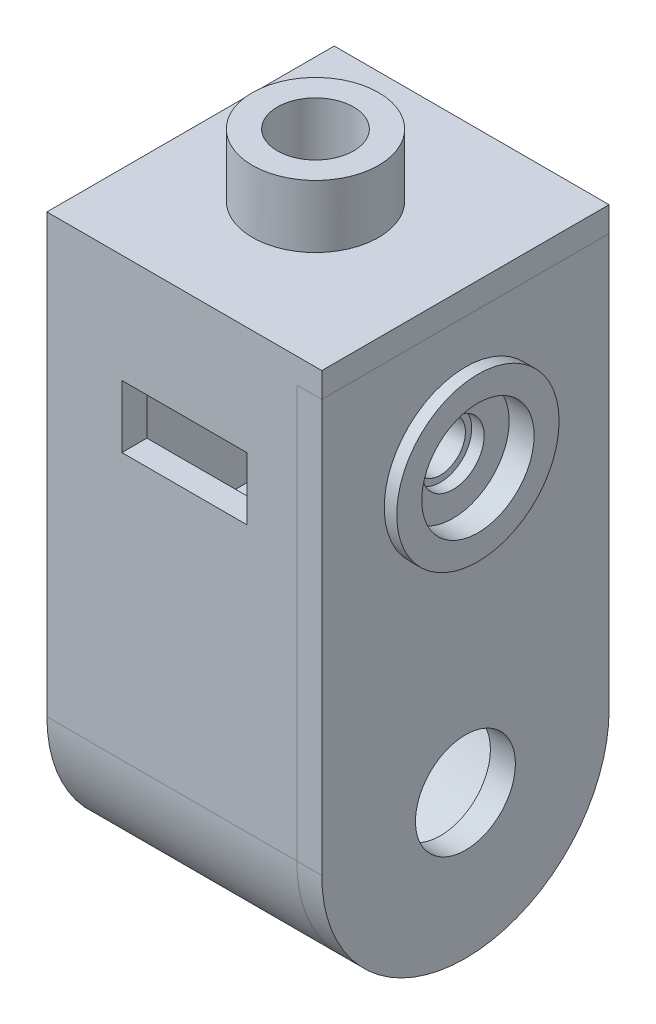
from build123d import *

# Parameters (mm, degrees)
SKETCH1_R            = 5.05
SKETCH1_R_2          = 3.05
BOSS_EXTRUDE1_DEPTH  = 7
SKETCH2_R            = 3.05
BOSS_EXTRUDE2_DEPTH  = 2
SKETCH3_W            = 20
SKETCH3_H            = 2
BOSS_EXTRUDE3_DEPTH  = 35
BOSS_EXTRUDE4_DEPTH  = 20
SKETCH5_W            = 8.1
SKETCH5_H            = 2
BOSS_EXTRUDE5_DEPTH  = 19
BOSS_EXTRUDE6_DEPTH  = 8.1
BOSS_EXTRUDE7_DEPTH  = 2
SKETCH8_R            = 3.9
BOSS_EXTRUDE8_DEPTH  = 7
SKETCH9_R            = 4
BOSS_EXTRUDE9_DEPTH  = 18
SKETCH10_R           = 2
CUT_EXTRUDE1_DEPTH   = 6
CUT_EXTRUDE1_DRAFT   = -2
BOSS_EXTRUDE10_DEPTH = 2
CUT_EXTRUDE2_DEPTH   = 2
BOSS_EXTRUDE11_START = -2
SKETCH13_W           = 22
SKETCH13_H           = 23
SKETCH13_R           = 5.05
BOSS_EXTRUDE11_DEPTH = 2
SKETCH14_R           = 2.5
CUT_EXTRUDE3_DEPTH   = 2
SKETCH15_R           = 4.5
SKETCH15_R_2         = 2.5
CUT_EXTRUDE4_DEPTH   = 1
SKETCH16_R           = 6.5
SKETCH16_R_2         = 4.5
BOSS_EXTRUDE12_DEPTH = 1
SKETCH18_R           = 4
CUT_EXTRUDE6_DEPTH   = 2
SKETCH19_W           = 10
SKETCH19_H           = 5
CUT_EXTRUDE7_DEPTH   = 2
SKETCH20_W           = 10
SKETCH20_H           = 5
CUT_EXTRUDE8_DEPTH   = 2
SKETCH21_R           = 2
BOSS_EXTRUDE13_DEPTH = 2


with BuildPart() as part:
    # Sketch1 → Boss-Extrude1 (new body)
    with BuildSketch(Plane(origin=(0, 0, 0), x_dir=(1, 0, 0), z_dir=(0, 1, 0))):
        with Locations(Location((0, 0, 0), (0, 0, 270))):
            Circle(SKETCH1_R)
        with Locations(Location((0, 0, 0), (0, 0, 270))):
            Circle(SKETCH1_R_2, mode=Mode.SUBTRACT)
    extrude(amount=BOSS_EXTRUDE1_DEPTH)

    # Sketch2 → Boss-Extrude2 (add)
    with BuildSketch(Plane.XZ):
        with BuildLine():
            Line((-10, 11.5), (10, 11.5))
            ThreePointArc((10, 11.5), (21.5, 0), (10, -11.5))
            Line((10, -11.5), (-10, -11.5))
            ThreePointArc((-10, -11.5), (-21.5, 0), (-10, 11.5))
        make_face()
        with Locations(Location((0, 0, 0), (0, 0, 90))):
            Circle(SKETCH2_R, mode=Mode.SUBTRACT)
    extrude(amount=-BOSS_EXTRUDE2_DEPTH)

    # Sketch3 → Boss-Extrude3 (add)
    with BuildSketch(Plane(origin=(0, 2, 0), x_dir=(1, 0, 0), z_dir=(0, 1, 0))):
        with Locations((0, 10.5)):
            Rectangle(SKETCH3_W, SKETCH3_H)
        with Locations((0, -10.5)):
            Rectangle(SKETCH3_W, SKETCH3_H)
    extrude(amount=-BOSS_EXTRUDE3_DEPTH)

    # Sketch4 → Boss-Extrude4 (add)
    with BuildSketch(Plane.ZY.offset(10)):
        with BuildLine():
            Line((-11.5, -33), (-9.5, -33))
            ThreePointArc((-9.5, -33), (0, -42.5), (9.5, -33))
            Line((9.5, -33), (11.5, -33))
            ThreePointArc((11.5, -33), (0, -44.5), (-11.5, -33))
        make_face()
    extrude(amount=-BOSS_EXTRUDE4_DEPTH)

    # Sketch5 → Boss-Extrude5 (add)
    with BuildSketch(Plane(origin=(0, 0, 9.5), x_dir=(-1, 0, 0), z_dir=(0, 0, -1))):
        with Locations((5.95, -23.78)):
            Rectangle(SKETCH5_W, SKETCH5_H)
    extrude(amount=BOSS_EXTRUDE5_DEPTH)

    # Sketch6 → Boss-Extrude6 (add)
    with BuildSketch(Plane.ZY.offset(10)):
        with BuildLine():
            Line((9.5, -24.78), (2.693343647, -24.78))
            ThreePointArc((2.693343647, -24.78), (0, -41.65), (-2.693343647, -24.78))
            Line((-2.693343647, -24.78), (-9.5, -24.78))
            Line((-9.5, -24.78), (-9.5, -33))
            ThreePointArc((-9.5, -33), (0, -42.5), (9.5, -33))
            Line((9.5, -33), (9.5, -24.78))
        make_face()
    extrude(amount=-BOSS_EXTRUDE6_DEPTH)

    # Sketch7 → Boss-Extrude7 (add)
    with BuildSketch(Plane.ZY.offset(10)):
        with BuildLine():
            Line((-11.5, 2), (11.5, 2))
            Line((11.5, 2), (11.5, -33))
            ThreePointArc((11.5, -33), (0, -44.5), (-11.5, -33))
            Line((-11.5, -33), (-11.5, 2))
        make_face()
    extrude(amount=-BOSS_EXTRUDE7_DEPTH)

    # Sketch8 → Boss-Extrude8 (add)
    with BuildSketch(Plane.ZY.offset(10)):
        with Locations((0, -33)):
            Circle(SKETCH8_R)
    extrude(amount=BOSS_EXTRUDE8_DEPTH)

    # Sketch9 → Boss-Extrude9 (add)
    with BuildSketch(Plane(origin=(-8, 0, 0), x_dir=(0, 0, -1), z_dir=(1, 0, 0))):
        with Locations(Location((0, -10, 0), (0, 0, 180))):
            Circle(SKETCH9_R)
    extrude(amount=BOSS_EXTRUDE9_DEPTH)


with BuildPart() as cut_extrude1_tool:
    # Sketch10 → Cut-Extrude1 (with draft: the straight prism first)
    with BuildSketch(Plane(origin=(10, 0, 0), x_dir=(0, 0, -1), z_dir=(1, 0, 0))):
        with Locations((0, -10)):
            Circle(SKETCH10_R)
    extrude(amount=-CUT_EXTRUDE1_DEPTH)
    # Cut-Extrude1: the draft: its side faces are tilted about the plane it starts from
    cut_extrude1_sides = [cut_extrude1_tool.faces().sort_by_distance(p)[0] for p in [
        (7, -10, 2),
    ]]
    draft(cut_extrude1_sides, Plane(origin=(10, 0, 0), x_dir=(0, 0, -1), z_dir=(1, 0, 0)), CUT_EXTRUDE1_DRAFT)


with BuildPart() as part_1:
    add(part.part)

    # Cut-Extrude1: cut by cut_extrude1_tool
    add(cut_extrude1_tool.part, mode=Mode.SUBTRACT)

    # Sketch12 → Cut-Extrude2 (cut)
    with BuildSketch(Plane.XZ):
        with BuildLine():
            Line((-10, 11.5), (-10, -11.5))
            ThreePointArc((-10, -11.5), (-21.5, 0), (-10, 11.5))
        make_face()
        with BuildLine():
            Line((12, 11.324751653), (12, -11.324751653))
            ThreePointArc((12, -11.324751653), (21.5, 0), (12, 11.324751653))
        make_face()
    extrude(amount=-CUT_EXTRUDE2_DEPTH, mode=Mode.SUBTRACT)

    # Sketch13 → Boss-Extrude11 (add)
    with BuildSketch(Plane(origin=(0, 2, 0), x_dir=(1, 0, 0), z_dir=(0, 1, 0)).offset(BOSS_EXTRUDE11_START)):
        with Locations((1, 0)):
            Rectangle(SKETCH13_W, SKETCH13_H)
        with Locations(Location((0, 0, 0), (0, 0, 90))):
            Circle(SKETCH13_R, mode=Mode.SUBTRACT)
    extrude(amount=BOSS_EXTRUDE11_DEPTH)

    # Sketch19 → Cut-Extrude7 (cut)
    with BuildSketch(Plane(origin=(0, 0, -11.5), x_dir=(-1, 0, 0), z_dir=(0, 0, -1))):
        with Locations((-1, -9.184069539)):
            Rectangle(SKETCH19_W, SKETCH19_H)
    extrude(amount=-CUT_EXTRUDE7_DEPTH, mode=Mode.SUBTRACT)

    # Sketch20 → Cut-Extrude8 (cut)
    with BuildSketch(Plane.XY.offset(11.5)):
        with Locations((1, -9.184069539)):
            Rectangle(SKETCH20_W, SKETCH20_H)
    extrude(amount=-CUT_EXTRUDE8_DEPTH, mode=Mode.SUBTRACT)


with BuildPart() as body_2:
    # Sketch11 → Boss-Extrude10 (new body)
    with BuildSketch(Plane(origin=(10, 0, 0), x_dir=(0, 0, -1), z_dir=(1, 0, 0))):
        with BuildLine():
            Line((-11.5, 0), (11.5, 0))
            Line((11.5, 0), (11.5, -33))
            ThreePointArc((11.5, -33), (0, -44.5), (-11.5, -33))
            Line((-11.5, -33), (-11.5, 0))
        make_face()
    extrude(amount=BOSS_EXTRUDE10_DEPTH)

    # Sketch14 → Cut-Extrude3 (cut)
    with BuildSketch(Plane(origin=(12, 0, 0), x_dir=(0, 0, -1), z_dir=(1, 0, 0))):
        with Locations((0, -10)):
            Circle(SKETCH14_R)
    extrude(amount=-CUT_EXTRUDE3_DEPTH, mode=Mode.SUBTRACT)

    # Sketch15 → Cut-Extrude4 (cut)
    with BuildSketch(Plane(origin=(12, 0, 0), x_dir=(0, 0, -1), z_dir=(1, 0, 0))):
        with Locations((0, -10)):
            Circle(SKETCH15_R)
        with Locations((0, -10)):
            Circle(SKETCH15_R_2, mode=Mode.SUBTRACT)
    extrude(amount=-CUT_EXTRUDE4_DEPTH, mode=Mode.SUBTRACT)

    # Sketch16 → Boss-Extrude12 (add)
    with BuildSketch(Plane(origin=(12, 0, 0), x_dir=(0, 0, -1), z_dir=(1, 0, 0))):
        with Locations((0, -10)):
            Circle(SKETCH16_R)
        with Locations((0, -10)):
            Circle(SKETCH16_R_2, mode=Mode.SUBTRACT)
    extrude(amount=BOSS_EXTRUDE12_DEPTH)

    # Sketch18 → Cut-Extrude6 (cut)
    with BuildSketch(Plane(origin=(12, 0, 0), x_dir=(0, 0, -1), z_dir=(1, 0, 0))):
        with Locations((0, -33)):
            Circle(SKETCH18_R)
    extrude(amount=-CUT_EXTRUDE6_DEPTH, mode=Mode.SUBTRACT)


with BuildPart() as body_3:
    # Sketch21 → Boss-Extrude13 (new body)
    with BuildSketch(Plane(origin=(10, 0, 0), x_dir=(0, 0, -1), z_dir=(1, 0, 0))):
        with BuildLine():
            Line((-11.5, 0), (11.5, 0))
            Line((11.5, 0), (11.5, -33))
            ThreePointArc((11.5, -33), (0, -44.5), (-11.5, -33))
            Line((-11.5, -33), (-11.5, 0))
        make_face()
        with Locations((0, -10)):
            Circle(SKETCH21_R, mode=Mode.SUBTRACT)
    extrude(amount=BOSS_EXTRUDE13_DEPTH)


solid = Compound([part_1.part, body_2.part])
